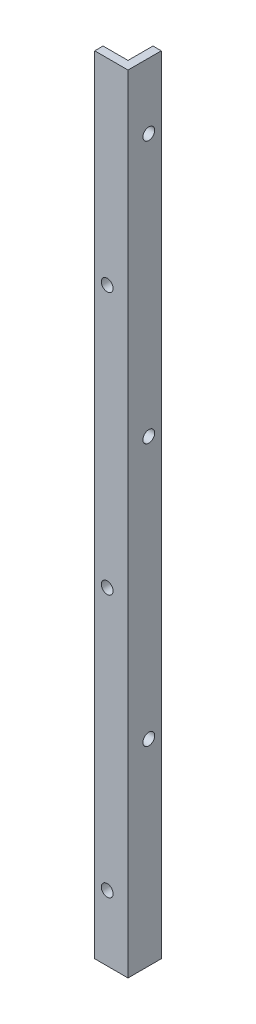
from build123d import *

# Parameters (mm, degrees)
BOSS_EXTRUDE1_DEPTH = 300
SKETCH2_R           = 2.25
CUT_EXTRUDE1_DEPTH  = 10
SKETCH3_R           = 2.25
CUT_EXTRUDE2_DEPTH  = 10


with BuildPart() as part:
    # Sketch1 → Boss-Extrude1 (new body)
    with BuildSketch(Plane(origin=(0, 0, 0), x_dir=(1, 0, 0), z_dir=(0, 1, 0))):
        Polygon((-12.7, 0), (0, 0), (0, 12.7), (-3.18, 12.7), (-3.18, 3.18), (-12.7, 3.18), align=None)
    extrude(amount=BOSS_EXTRUDE1_DEPTH)

    # Sketch2 → Cut-Extrude1 (cut)
    with BuildSketch(Plane.ZY.offset(3.18)):
        with Locations((-7.94, 275)):
            Circle(SKETCH2_R)
        with Locations((-7.94, 175)):
            Circle(SKETCH2_R)
        with Locations((-7.94, 75)):
            Circle(SKETCH2_R)
    extrude(amount=-CUT_EXTRUDE1_DEPTH, mode=Mode.SUBTRACT)

    # Sketch3 → Cut-Extrude2 (cut)
    with BuildSketch(Plane(origin=(0, 0, -3.18), x_dir=(-1, 0, 0), z_dir=(0, 0, -1))):
        with Locations((7.94, 225)):
            Circle(SKETCH3_R)
        with Locations((7.94, 125)):
            Circle(SKETCH3_R)
        with Locations((7.94, 25)):
            Circle(SKETCH3_R)
    extrude(amount=-CUT_EXTRUDE2_DEPTH, mode=Mode.SUBTRACT)


solid = part.part
